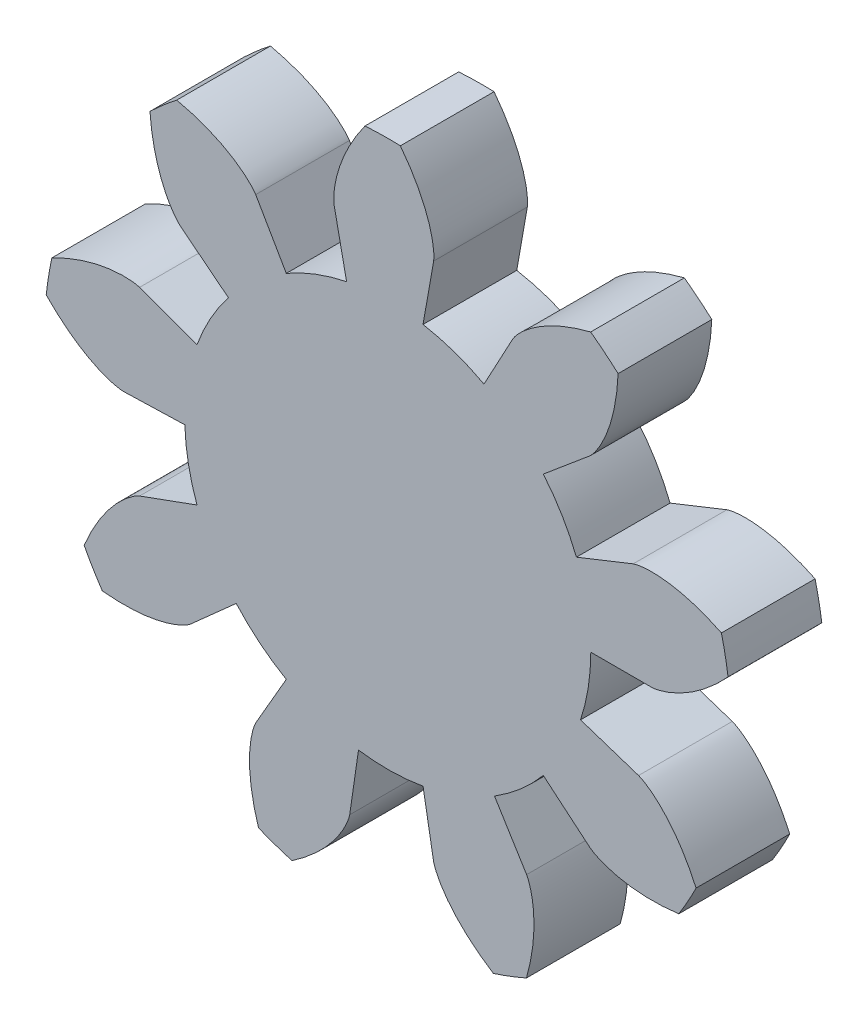
from build123d import *

# Parameters (mm, degrees)
SKETCH1_R           = 11.641666667
BOSS_EXTRUDE1_DEPTH = 3.175
CUT_EXTRUDE1_DEPTH  = 17.767153323
CIRPATTERN1_COUNT   = 9
SKETCH3_R           = 6.879166667
BOSS_EXTRUDE2_DEPTH = 3.175


with BuildPart() as part:
    # Sketch1 → Boss-Extrude1 (new body)
    with BuildSketch(Plane.XY):
        Circle(SKETCH1_R)
    extrude(amount=-BOSS_EXTRUDE1_DEPTH)

    # Sketch2 → Cut-Extrude1 (cut, symmetric)
    with BuildSketch(Plane.XY):
        with BuildLine():
            Line((8.950572213, 0), (3.439583333, 0))
            ThreePointArc((3.439583333, 0), (3.395853831, -0.546726867), (3.265777242, -1.079551995))
            Line((3.265777242, -1.079551995), (8.498289533, -2.809237966))
            add(Edge.make_bspline(
                [(8.498289533, -2.809237966), (8.524107142, -2.81903439), (8.595071373, -2.849882073), (8.724139002, -2.922012055), (8.922733685, -3.057013494), (9.161567466, -3.256746111), (9.444058405, -3.540008267), (9.741774242, -3.902261027), (10.031087423, -4.328355551), (10.243289572, -4.709350489), (10.373002645, -4.976586508), (10.438042502, -5.120920013), (10.446063139, -5.138887786)],
                knots=[0, 0, 0, 0, 0, 0.005604071, 0.015718253, 0.029959921, 0.048733673, 0.068727069, 0.096888899, 0.125050573, 0.153212241, 0.157209322, 0.157209322, 0.157209322, 0.157209322, 0.157209322], degree=4))
            ThreePointArc((10.446063139, -5.138887786), (11.338826831, -2.638069156), (11.641666667, 0))
            ThreePointArc((11.641666667, 0), (11.613994471, 0.802206464), (11.531109436, 1.600599245))
            add(Edge.make_bspline(
                [(8.950572213, 0), (8.978159946, 0.001198252), (9.055220167, 0.008214243), (9.200404668, 0.036190084), (9.431335857, 0.102038566), (9.720789426, 0.216717791), (10.077910794, 0.39700342), (10.474279819, 0.647509661), (10.882708242, 0.961268939), (11.203767129, 1.256409729), (11.410800688, 1.469430096), (11.517854704, 1.586056771), (11.531109436, 1.600599245)],
                knots=[0, 0, 0, 0, 0, 0.005604071, 0.015718253, 0.029959921, 0.048733673, 0.068727069, 0.096888899, 0.125050573, 0.153212241, 0.157209322, 0.157209322, 0.157209322, 0.157209322, 0.157209322], degree=4))
        make_face()
    cut_extrude1 = extrude(amount=CUT_EXTRUDE1_DEPTH, both=True, mode=Mode.SUBTRACT)

    # CirPattern1: Cut-Extrude1 ×9 about axis
    cirpattern1_axis = Axis((0, 0, -3.175), (0, 0, 1))
    for i in range(1, CIRPATTERN1_COUNT):
        add(cut_extrude1.rotate(cirpattern1_axis, i * 360 / CIRPATTERN1_COUNT), mode=Mode.SUBTRACT)

    # Sketch3 → Boss-Extrude2 (add)
    with BuildSketch(Plane.XY):
        Circle(SKETCH3_R)
    extrude(amount=-BOSS_EXTRUDE2_DEPTH)


solid = part.part
